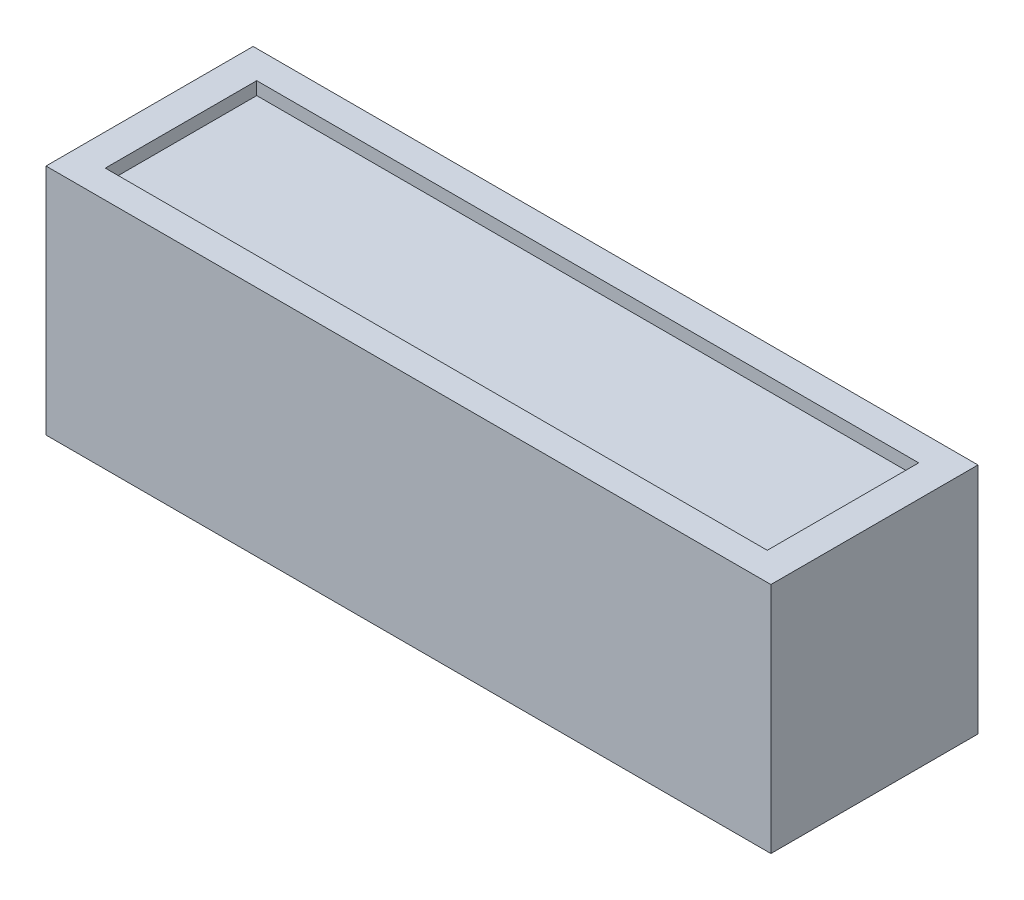
from build123d import *

# Parameters (mm, degrees)
SKETCH1_W           = 28
SKETCH1_H           = 9
BOSS_EXTRUDE1_DEPTH = 8
CUT_EXTRUDE1_DEPTH  = 0.5


with BuildPart() as part:
    # Sketch1 → Boss-Extrude1 (new body)
    with BuildSketch(Plane.XY):
        with Locations((14, 4.5)):
            Rectangle(SKETCH1_W, SKETCH1_H)
    extrude(amount=BOSS_EXTRUDE1_DEPTH)

    # Sketch2 → Cut-Extrude1 (cut)
    with BuildSketch(Plane(origin=(0, 9, 0), x_dir=(1, 0, 0), z_dir=(0, 1, 0))):
        Polygon((14, -1.074899), (1.215291321, -1.074899), (1.215291321, -4), (1.215291321, -6.925101), (26.784708679, -6.925101), (26.784708679, -1.074899), align=None)
    extrude(amount=-CUT_EXTRUDE1_DEPTH, mode=Mode.SUBTRACT)


solid = part.part
